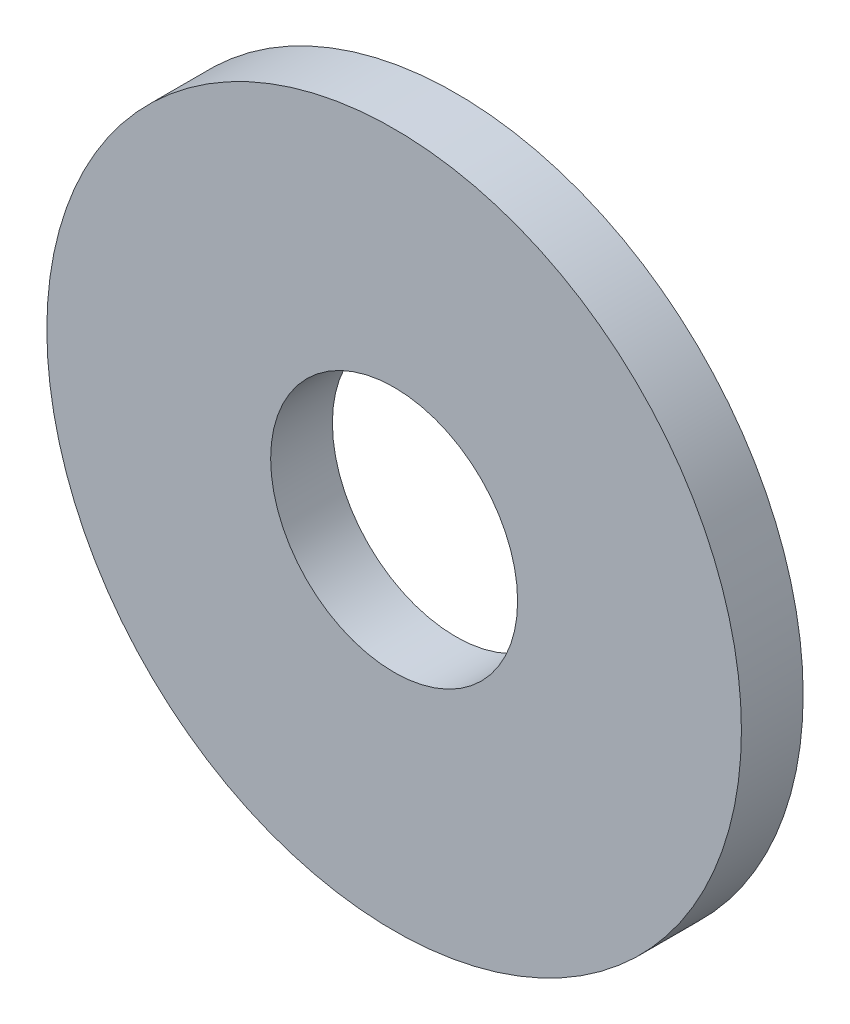
from build123d import *

# Parameters (mm, degrees)
SKETCH_1_R      = 9
SKETCH_1_R_2    = 3.2
EXTRUDE_1_DEPTH = 1.6


with BuildPart() as part:
    # Эскиз1 → Бобышка-Вытянуть1 (new body)
    with BuildSketch(Plane.XY):
        Circle(SKETCH_1_R)
        Circle(SKETCH_1_R_2, mode=Mode.SUBTRACT)
    extrude(amount=EXTRUDE_1_DEPTH)


solid = part.part
